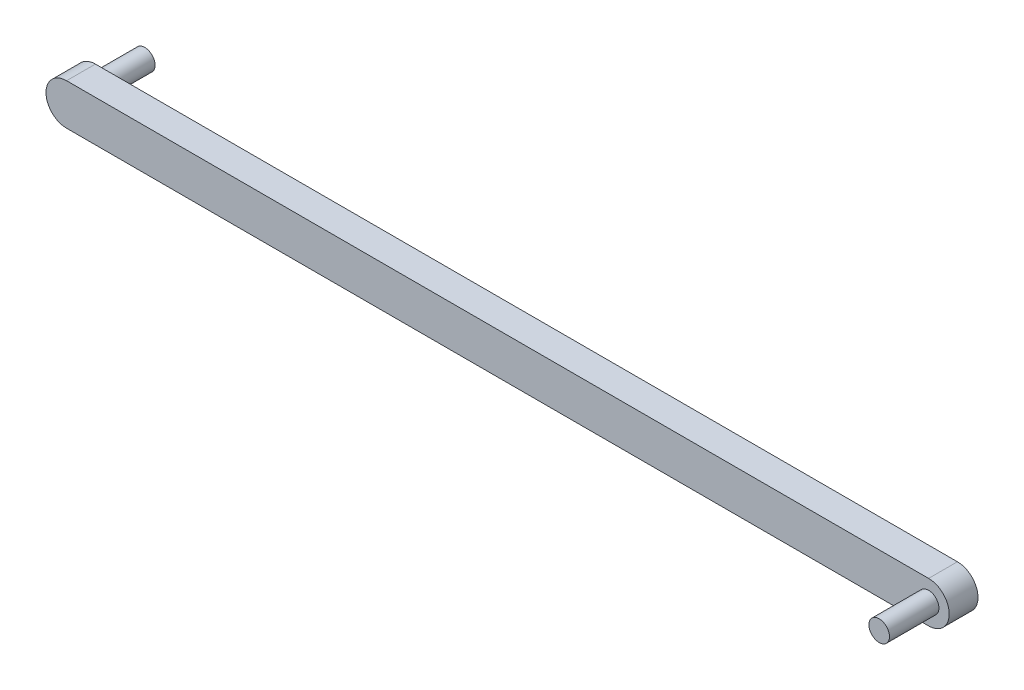
from build123d import *

# Parameters (mm, degrees)
BOSS_EXTRUDE1_DEPTH = 3.5
SKETCH2_R           = 1.25
BOSS_EXTRUDE2_DEPTH = 6
SKETCH3_R           = 1.25
BOSS_EXTRUDE3_DEPTH = 6


with BuildPart() as part:
    # Sketch1 → Boss-Extrude1 (new body)
    with BuildSketch(Plane.XY):
        with BuildLine():
            Line((-52.349, 2.5), (52.349, 2.5))
            ThreePointArc((52.349, 2.5), (54.849, 0), (52.349, -2.5))
            Line((52.349, -2.5), (-52.349, -2.5))
            ThreePointArc((-52.349, -2.5), (-54.849, 0), (-52.349, 2.5))
        make_face()
    extrude(amount=BOSS_EXTRUDE1_DEPTH)

    # Sketch2 → Boss-Extrude2 (add)
    with BuildSketch(Plane.XY.offset(3.5)):
        with Locations((52.349, 0)):
            Circle(SKETCH2_R)
    extrude(amount=BOSS_EXTRUDE2_DEPTH)

    # Sketch3 → Boss-Extrude3 (add)
    with BuildSketch(Plane(origin=(0, 0, 0), x_dir=(-1, 0, 0), z_dir=(0, 0, -1))):
        with Locations(Location((52.349, 0, 0), (0, 0, 180))):
            Circle(SKETCH3_R)
    extrude(amount=BOSS_EXTRUDE3_DEPTH)


solid = part.part
